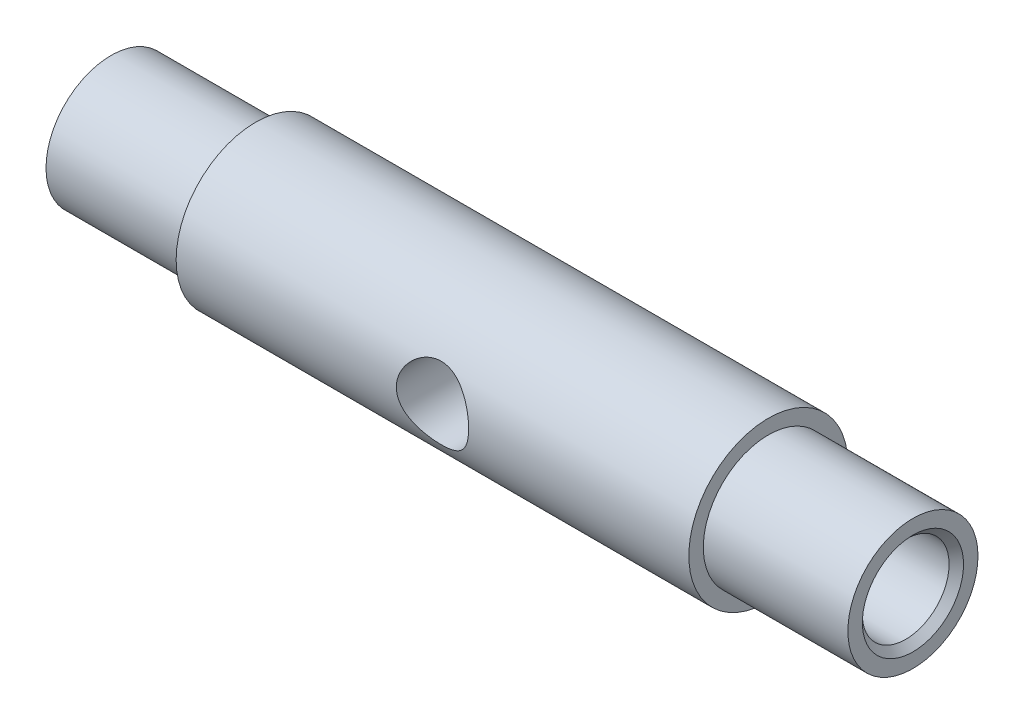
from build123d import *

# Parameters (mm, degrees)
BOSS_EXTRUDE1_DEPTH                                 = 13.865
BOSS_EXTRUDE1_DEPTH_BACK                            = 13.865
SKETCH1_R                                           = 2.75
SKETCH2_R                                           = 2.75
SKETCH2_R_2                                         = 2.25
CUT_EXTRUDE1_DEPTH                                  = 5
CUT_EXTRUDE2_START                                  = -5
SKETCH3_R                                           = 2.75
SKETCH3_R_2                                         = 2.25
CUT_EXTRUDE2_DEPTH                                  = 5
CSK_FOR_M3_COUNTERSUNK_FLAT_HEAD_SCREW1_D           = 3
CSK_FOR_M3_COUNTERSUNK_FLAT_HEAD_SCREW1_DEPTH       = 10
CSK_FOR_M3_COUNTERSUNK_FLAT_HEAD_SCREW1_CSINK_D     = 3.5
CSK_FOR_M3_COUNTERSUNK_FLAT_HEAD_SCREW1_CSINK_ANGLE = 90
CSK_FOR_M3_COUNTERSUNK_FLAT_HEAD_SCREW1_TIP         = 0.901290929
CSK_FOR_M3_COUNTERSUNK_FLAT_HEAD_SCREW2_D           = 3
CSK_FOR_M3_COUNTERSUNK_FLAT_HEAD_SCREW2_DEPTH       = 10
CSK_FOR_M3_COUNTERSUNK_FLAT_HEAD_SCREW2_CSINK_D     = 3.5
CSK_FOR_M3_COUNTERSUNK_FLAT_HEAD_SCREW2_CSINK_ANGLE = 90
CSK_FOR_M3_COUNTERSUNK_FLAT_HEAD_SCREW2_TIP         = 0.901290929
SKETCH8_W                                           = 7.4
SKETCH8_H                                           = 4
CUT_EXTRUDE3_DEPTH                                  = 3
SKETCH9_R                                           = 1.25
CUT_EXTRUDE4_DEPTH                                  = 16.023608921


with BuildPart() as part:
    # Sketch1 → Boss-Extrude1 (new, two sides: drawn at the far end of the back side and taken through both)
    with BuildSketch(Plane(origin=(0, 0, 0), x_dir=(0, 0, -1), z_dir=(1, 0, 0)).offset(-BOSS_EXTRUDE1_DEPTH_BACK)):
        Circle(SKETCH1_R)
    extrude(amount=BOSS_EXTRUDE1_DEPTH + BOSS_EXTRUDE1_DEPTH_BACK)

    # Sketch2 → Cut-Extrude1 (cut)
    with BuildSketch(Plane(origin=(13.865, 0, 0), x_dir=(0, 0, -1), z_dir=(1, 0, 0))):
        Circle(SKETCH2_R)
        Circle(SKETCH2_R_2, mode=Mode.SUBTRACT)
    extrude(amount=-CUT_EXTRUDE1_DEPTH, mode=Mode.SUBTRACT)

    # Sketch3 → Cut-Extrude2 (cut)
    with BuildSketch(Plane.ZY.offset(13.865).offset(CUT_EXTRUDE2_START)):
        Circle(SKETCH3_R)
        Circle(SKETCH3_R_2, mode=Mode.SUBTRACT)
    extrude(amount=CUT_EXTRUDE2_DEPTH, mode=Mode.SUBTRACT)

    # CSK for M3 Countersunk Flat Head Screw1
    with Locations(Plane.ZY.offset(13.865)):
        with Locations((0, 0)):
            CounterSinkHole(CSK_FOR_M3_COUNTERSUNK_FLAT_HEAD_SCREW1_D / 2, CSK_FOR_M3_COUNTERSUNK_FLAT_HEAD_SCREW1_CSINK_D / 2, depth=CSK_FOR_M3_COUNTERSUNK_FLAT_HEAD_SCREW1_DEPTH, counter_sink_angle=CSK_FOR_M3_COUNTERSUNK_FLAT_HEAD_SCREW1_CSINK_ANGLE)
            with Locations((0, 0, -(CSK_FOR_M3_COUNTERSUNK_FLAT_HEAD_SCREW1_DEPTH + CSK_FOR_M3_COUNTERSUNK_FLAT_HEAD_SCREW1_TIP / 2))):  # 118° drill point
                Cone(0, CSK_FOR_M3_COUNTERSUNK_FLAT_HEAD_SCREW1_D / 2, CSK_FOR_M3_COUNTERSUNK_FLAT_HEAD_SCREW1_TIP, mode=Mode.SUBTRACT)

    # CSK for M3 Countersunk Flat Head Screw2
    with Locations(Plane(origin=(13.865, 0, 0), x_dir=(0, 0, -1), z_dir=(1, 0, 0))):
        with Locations((0, 0)):
            CounterSinkHole(CSK_FOR_M3_COUNTERSUNK_FLAT_HEAD_SCREW2_D / 2, CSK_FOR_M3_COUNTERSUNK_FLAT_HEAD_SCREW2_CSINK_D / 2, depth=CSK_FOR_M3_COUNTERSUNK_FLAT_HEAD_SCREW2_DEPTH, counter_sink_angle=CSK_FOR_M3_COUNTERSUNK_FLAT_HEAD_SCREW2_CSINK_ANGLE)
            with Locations((0, 0, -(CSK_FOR_M3_COUNTERSUNK_FLAT_HEAD_SCREW2_DEPTH + CSK_FOR_M3_COUNTERSUNK_FLAT_HEAD_SCREW2_TIP / 2))):  # 118° drill point
                Cone(0, CSK_FOR_M3_COUNTERSUNK_FLAT_HEAD_SCREW2_D / 2, CSK_FOR_M3_COUNTERSUNK_FLAT_HEAD_SCREW2_TIP, mode=Mode.SUBTRACT)

    # Sketch8 → Cut-Extrude3 (cut)
    with BuildSketch(Plane.XY.offset(-5.34)):
        Rectangle(SKETCH8_W, SKETCH8_H)
    extrude(amount=CUT_EXTRUDE3_DEPTH, mode=Mode.SUBTRACT)

    # Sketch9 → Cut-Extrude4 (cut, through all)
    with BuildSketch(Plane(origin=(0, 0, -2.34), x_dir=(-1, 0, 0), z_dir=(0, 0, -1))):
        Circle(SKETCH9_R)
    extrude(amount=-CUT_EXTRUDE4_DEPTH, mode=Mode.SUBTRACT)


solid = part.part
